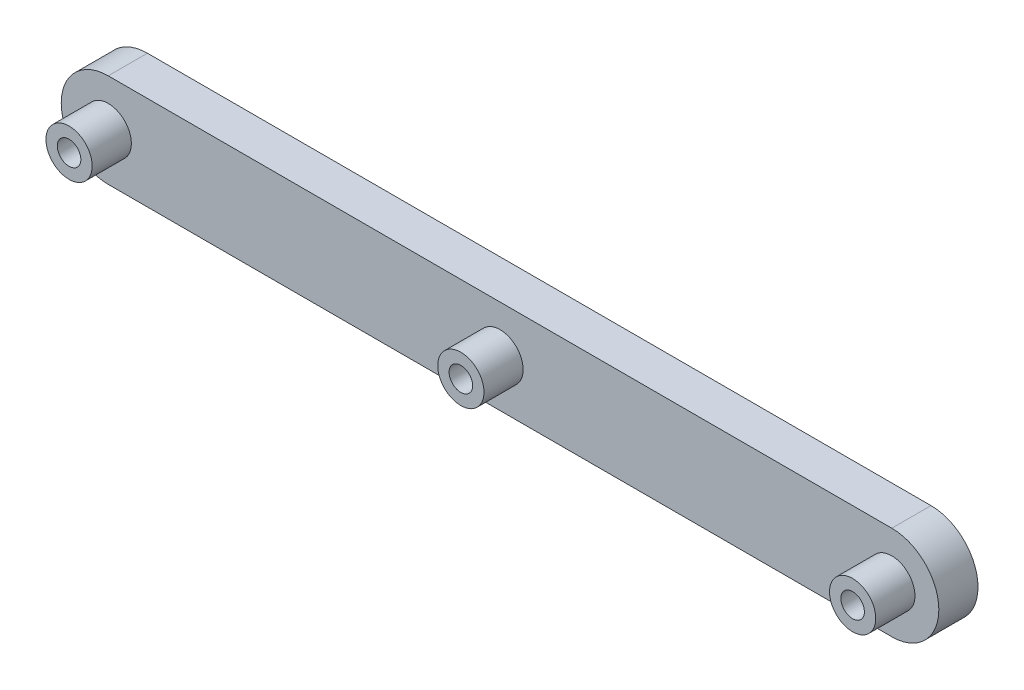
from build123d import *

# Parameters (mm, degrees)
SKETCH1_R           = 1.5
BOSS_EXTRUDE1_DEPTH = 5
SKETCH2_R           = 2.95
SKETCH2_R_2         = 1.5
BOSS_EXTRUDE2_DEPTH = 5
SKETCH4_R           = 2.5
CUT_EXTRUDE1_DEPTH  = 2


with BuildPart() as part:
    # Sketch1 → Boss-Extrude1 (new body)
    with BuildSketch(Plane.XY):
        with BuildLine():
            Line((-50, 6), (50, 6))
            ThreePointArc((50, 6), (56, 0), (50, -6))
            Line((50, -6), (-50, -6))
            ThreePointArc((-50, -6), (-56, 0), (-50, 6))
        make_face()
        with Locations((-50, 0)):
            Circle(SKETCH1_R, mode=Mode.SUBTRACT)
        with Locations((50, 0)):
            Circle(SKETCH1_R, mode=Mode.SUBTRACT)
        Circle(SKETCH1_R, mode=Mode.SUBTRACT)
    extrude(amount=BOSS_EXTRUDE1_DEPTH)

    # Sketch2 → Boss-Extrude2 (add)
    # profile 1 of 3: a face of its own
    with BuildSketch(Plane.XY.offset(5)):
        with Locations((-50, 0)):
            Circle(SKETCH2_R)
        with Locations((-50, 0)):
            Circle(SKETCH2_R_2, mode=Mode.SUBTRACT)
    # profile 2 of 3: a face of its own
    with BuildSketch(Plane.XY.offset(5)):
        Circle(SKETCH2_R)
        Circle(SKETCH2_R_2, mode=Mode.SUBTRACT)
    # profile 3 of 3: a face of its own
    with BuildSketch(Plane.XY.offset(5)):
        with Locations((50, 0)):
            Circle(SKETCH2_R)
        with Locations((50, 0)):
            Circle(SKETCH2_R_2, mode=Mode.SUBTRACT)
    extrude(amount=BOSS_EXTRUDE2_DEPTH)

    # Sketch4 → Cut-Extrude1 (cut)
    with BuildSketch(Plane(origin=(0, 0, 0), x_dir=(-1, 0, 0), z_dir=(0, 0, -1))):
        with Locations((-50, 0)):
            Circle(SKETCH4_R)
        Circle(SKETCH4_R)
        with Locations((50, 0)):
            Circle(SKETCH4_R)
    extrude(amount=-CUT_EXTRUDE1_DEPTH, mode=Mode.SUBTRACT)


solid = part.part
